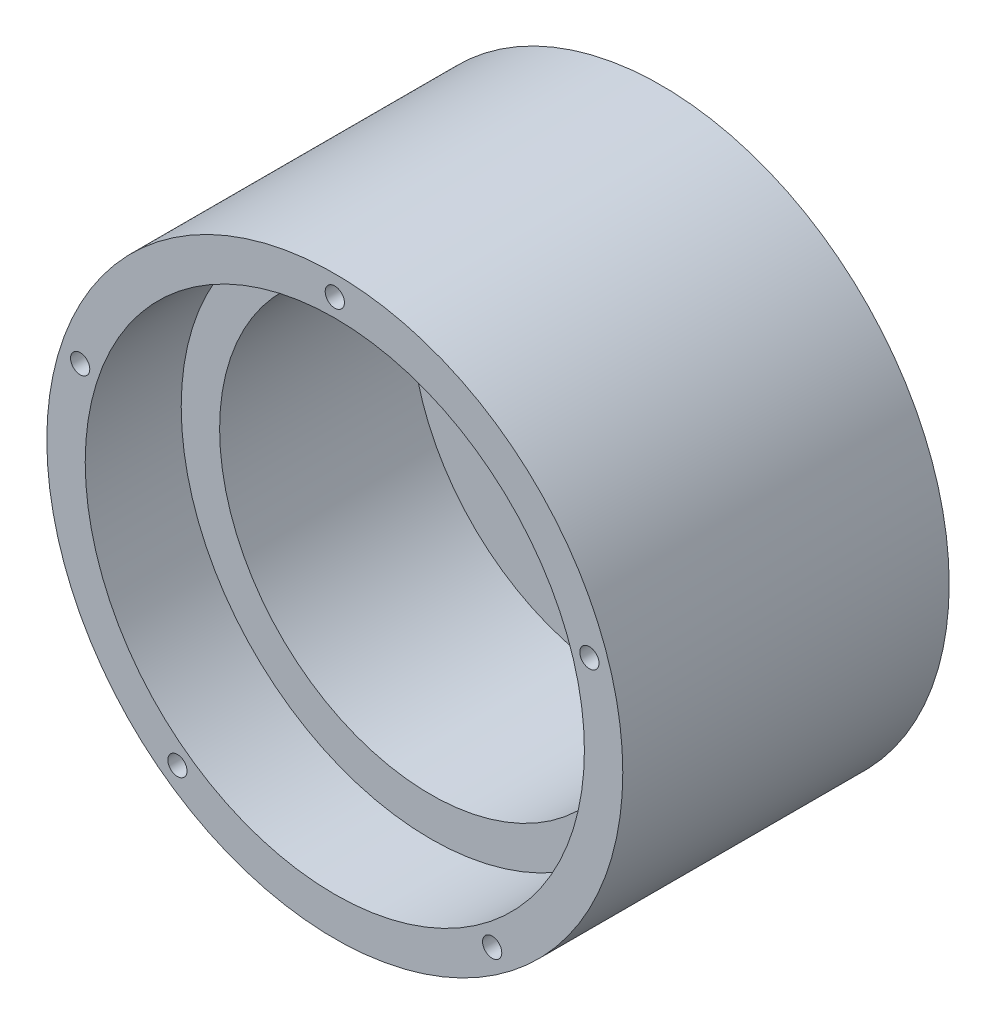
from build123d import *

# Parameters (mm, degrees)
SKETCH2_R           = 75
BOSS_EXTRUDE1_DEPTH = 85
SKETCH4_R           = 65
CUT_EXTRUDE2_DEPTH  = 25
SKETCH5_R           = 55
CUT_EXTRUDE3_DEPTH  = 50
SKETCH7_R           = 2.5
CUT_EXTRUDE4_DEPTH  = 20
CIRPATTERN1_COUNT   = 5
SKETCH8_R           = 2.5
CUT_EXTRUDE5_DEPTH  = 10
CIRPATTERN2_COUNT   = 4


with BuildPart() as part:
    # Sketch2 → Boss-Extrude1 (new body)
    with BuildSketch(Plane(origin=(0, 0, 0), x_dir=(0, 1, 0), z_dir=(0, 0, 1))):
        with Locations(Location((0, 0, 0), (0, 0, 270))):
            Circle(SKETCH2_R)
    extrude(amount=BOSS_EXTRUDE1_DEPTH)

    # Sketch4 → Cut-Extrude2 (cut)
    with BuildSketch(Plane.XY.offset(85)):
        Circle(SKETCH4_R)
    extrude(amount=-CUT_EXTRUDE2_DEPTH, mode=Mode.SUBTRACT)

    # Sketch5 → Cut-Extrude3 (cut)
    with BuildSketch(Plane.XY.offset(60)):
        Circle(SKETCH5_R)
    extrude(amount=-CUT_EXTRUDE3_DEPTH, mode=Mode.SUBTRACT)

    # Sketch7 → Cut-Extrude4 (cut)
    with BuildSketch(Plane.XY.offset(85)):
        with Locations((0, 69.72339814)):
            Circle(SKETCH7_R)
    cut_extrude4 = extrude(amount=-CUT_EXTRUDE4_DEPTH, mode=Mode.SUBTRACT)

    # CirPattern1: Cut-Extrude4 ×5 about axis
    cirpattern1_axis = Axis((0, 0, 0), (0, 0, 1))
    for i in range(1, CIRPATTERN1_COUNT):
        add(cut_extrude4.rotate(cirpattern1_axis, i * 360 / CIRPATTERN1_COUNT), mode=Mode.SUBTRACT)

    # Sketch8 → Cut-Extrude5 (cut)
    with BuildSketch(Plane(origin=(0, 0, 0), x_dir=(1, 0, 0), z_dir=(0, 0, -1))):
        with Locations(Location((0, 70, 0), (0, 0, 180))):
            Circle(SKETCH8_R)
    cut_extrude5 = extrude(amount=-CUT_EXTRUDE5_DEPTH, mode=Mode.SUBTRACT)

    # CirPattern2: Cut-Extrude5 ×4 about axis
    cirpattern2_axis = Axis((0, 0.077864294, 0), (0, 0, 1))
    for i in range(1, CIRPATTERN2_COUNT):
        add(cut_extrude5.rotate(cirpattern2_axis, i * 360 / CIRPATTERN2_COUNT), mode=Mode.SUBTRACT)


solid = part.part
